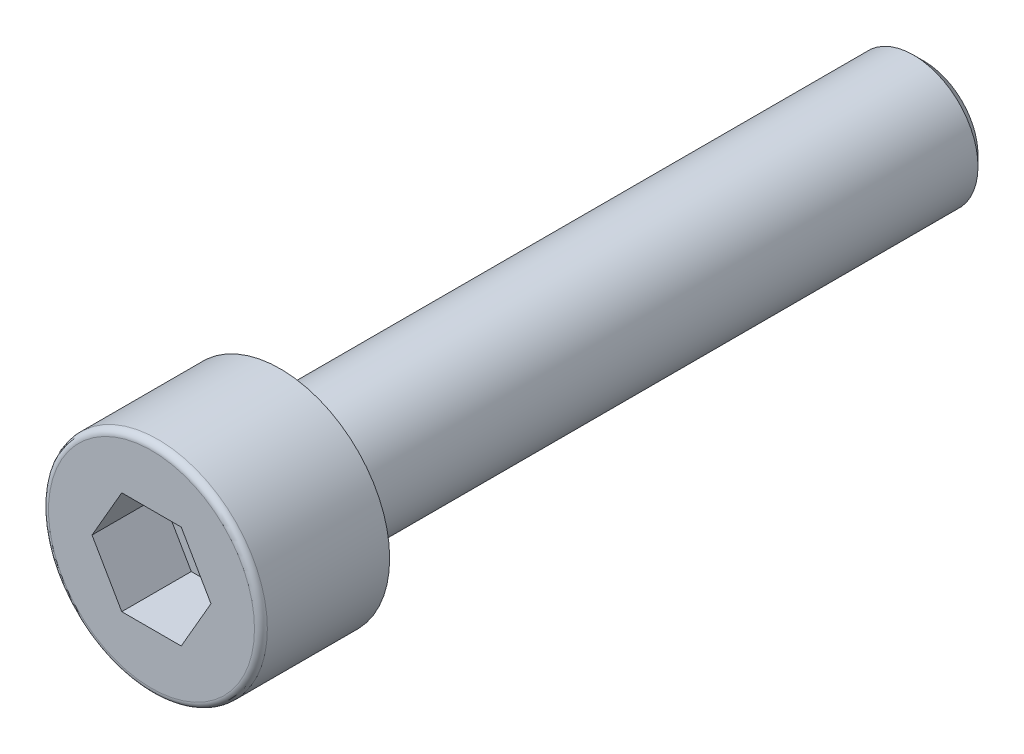
from build123d import *

# Parameters (mm, degrees)
CUT_EXTRUDE1_DEPTH = 2.7
CHAMFER1_SIZE      = 0.4


with BuildPart() as part:
    # Sketch1 → Revolve1 (revolve)
    with BuildSketch(Plane.XZ, mode=Mode.PRIVATE) as revolve1_sk:
        with BuildLine():
            Line((0, -25), (-2.5, -25))
            Line((-2.5, -25), (-2.5, 0))
            Line((-2.5, 0), (-4.25, 0))
            Line((-4.25, 0), (-4.25, 4.75))
            ThreePointArc((-4.25, 4.75), (-4.176776695, 4.926776695), (-4, 5))
            Line((-4, 5), (0, 5))
            Line((0, 5), (0, -25))
        make_face()
    revolve(revolve1_sk.sketch.rotate(Axis((0, 0, 5), (0, 0, -1)), 180), axis=Axis((0, 0, 5), (0, 0, -1)))

    # Sketch2 → Cut-Extrude1 (cut)
    with BuildSketch(Plane.XY.offset(5)):
        Polygon((2.309401077, 0), (1.154700538, 2), (-1.154700538, 2), (-2.309401077, 0), (-1.154700538, -2), (1.154700538, -2), align=None)
    extrude(amount=-CUT_EXTRUDE1_DEPTH, mode=Mode.SUBTRACT)

    # Chamfer1
    chamfer1_edges = [part.edges().sort_by_distance(p)[0] for p in [
        (-2.5, 0, -25),
    ]]
    chamfer(chamfer1_edges, length=CHAMFER1_SIZE)


solid = part.part
